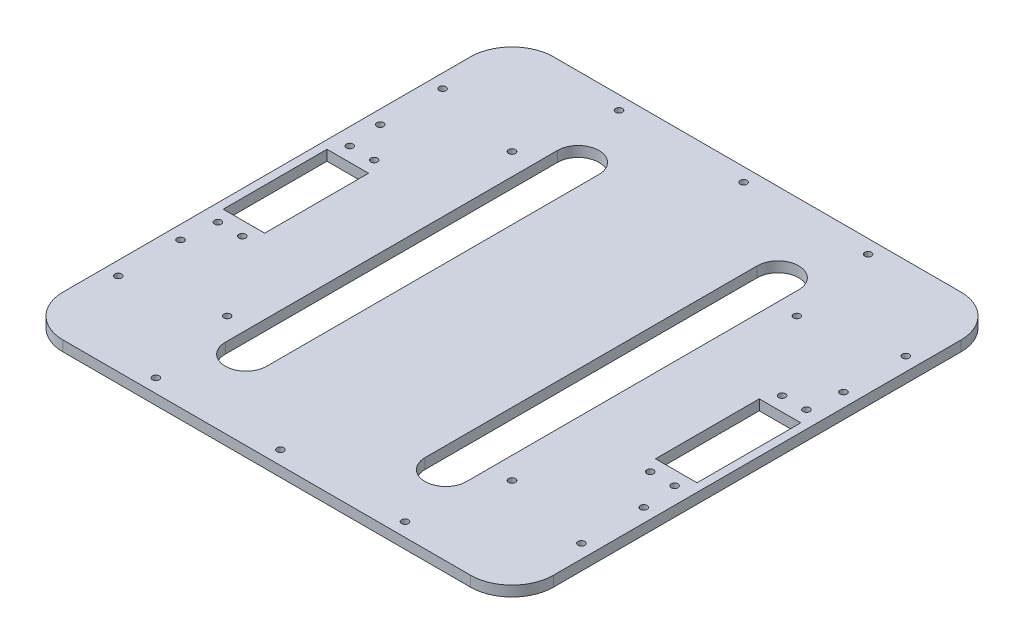
from build123d import *

# Parameters (mm, degrees)
SKETCH1_W           = 300
SKETCH1_H           = 300
BOSS_EXTRUDE1_DEPTH = 6.35
SKETCH2_R           = 2.0828
SKETCH2_W           = 25.4
SKETCH2_H           = 63.5
CUT_EXTRUDE1_DEPTH  = 213.227054119
FILLET1_R           = 25.4


with BuildPart() as part:
    # Sketch1 → Boss-Extrude1 (new body)
    with BuildSketch(Plane(origin=(0, 0, 0), x_dir=(1, 0, 0), z_dir=(0, 1, 0))):
        Rectangle(SKETCH1_W, SKETCH1_H)
    extrude(amount=BOSS_EXTRUDE1_DEPTH)

    # Sketch2 → Cut-Extrude1 (cut, through all)
    with BuildSketch(Plane(origin=(0, 6.35, 0), x_dir=(1, 0, 0), z_dir=(0, 1, 0))):
        with Locations(Location((-87.138207153, 87.138207153, 0), (0, 0, 270))):
            Circle(SKETCH2_R)
        with Locations(Location((87.138207153, 87.138207153, 0), (0, 0, 90))):
            Circle(SKETCH2_R)
        with Locations(Location((87.138207153, -87.138207153, 0), (0, 0, 270))):
            Circle(SKETCH2_R)
        with Locations(Location((-87.138207153, -87.138207153, 0), (0, 0, 90))):
            Circle(SKETCH2_R)
        with Locations(Location((-141.6688, 99.2, 0), (0, 0, 270))):
            Circle(SKETCH2_R)
        with Locations(Location((-141.6688, 61.1, 0), (0, 0, 270))):
            Circle(SKETCH2_R)
        with Locations(Location((-141.6688, -99.2, 0), (0, 0, 270))):
            Circle(SKETCH2_R)
        with Locations(Location((-141.6688, -61.1, 0), (0, 0, 270))):
            Circle(SKETCH2_R)
        with Locations(Location((-76.2, -141.6688, 0), (0, 0, 270))):
            Circle(SKETCH2_R)
        with Locations(Location((76.2, -141.6688, 0), (0, 0, 270))):
            Circle(SKETCH2_R)
        with Locations(Location((0, -141.6688, 0), (0, 0, 270))):
            Circle(SKETCH2_R)
        with Locations(Location((-76.2, 141.6688, 0), (0, 0, 270))):
            Circle(SKETCH2_R)
        with Locations(Location((0, 141.6688, 0), (0, 0, 270))):
            Circle(SKETCH2_R)
        with Locations(Location((76.2, 141.6688, 0), (0, 0, 270))):
            Circle(SKETCH2_R)
        with Locations(Location((141.6688, 99.2, 0), (0, 0, 270))):
            Circle(SKETCH2_R)
        with Locations(Location((141.6688, 61.1, 0), (0, 0, 270))):
            Circle(SKETCH2_R)
        with Locations(Location((141.6688, -99.2, 0), (0, 0, 270))):
            Circle(SKETCH2_R)
        with Locations(Location((141.6688, -61.1, 0), (0, 0, 270))):
            Circle(SKETCH2_R)
        with Locations(Location((-139.6622, 40.4492, 0), (0, 0, 270))):
            Circle(SKETCH2_R)
        with Locations(Location((-124.7778, 40.4492, 0), (0, 0, 270))):
            Circle(SKETCH2_R)
        with Locations(Location((-139.6622, -40.2212, 0), (0, 0, 270))):
            Circle(SKETCH2_R)
        with Locations(Location((-124.7778, -40.2212, 0), (0, 0, 270))):
            Circle(SKETCH2_R)
        with Locations(Location((124.7778, 40.4492, 0), (0, 0, 270))):
            Circle(SKETCH2_R)
        with Locations(Location((139.6622, 40.4492, 0), (0, 0, 270))):
            Circle(SKETCH2_R)
        with Locations(Location((124.7778, -40.2212, 0), (0, 0, 270))):
            Circle(SKETCH2_R)
        with Locations(Location((139.6622, -40.2212, 0), (0, 0, 270))):
            Circle(SKETCH2_R)
        with BuildLine():
            Line((-73.8, -101.6), (-73.8, 101.6))
            ThreePointArc((-73.8, 101.6), (-61.1, 114.3), (-48.4, 101.6))
            Line((-48.4, 101.6), (-48.4, -101.6))
            ThreePointArc((-48.4, -101.6), (-61.1, -114.3), (-73.8, -101.6))
        make_face()
        with BuildLine():
            Line((73.8, -101.6), (73.8, 101.6))
            ThreePointArc((73.8, 101.6), (61.1, 114.3), (48.4, 101.6))
            Line((48.4, 101.6), (48.4, -101.6))
            ThreePointArc((48.4, -101.6), (61.1, -114.3), (73.8, -101.6))
        make_face()
        with Locations((132.219999974, 0)):
            Rectangle(SKETCH2_W, SKETCH2_H)
        with Locations((-132.219999974, 0)):
            Rectangle(SKETCH2_W, SKETCH2_H)
    extrude(amount=-CUT_EXTRUDE1_DEPTH, mode=Mode.SUBTRACT)

    # Fillet1
    fillet1_edges = [part.edges().sort_by_distance(p)[0] for p in [
        (150, 3.175, 150),
        (-150, 3.175, 150),
        (-150, 3.175, -150),
        (150, 3.175, -150),
    ]]
    fillet(fillet1_edges, radius=FILLET1_R)


solid = part.part
